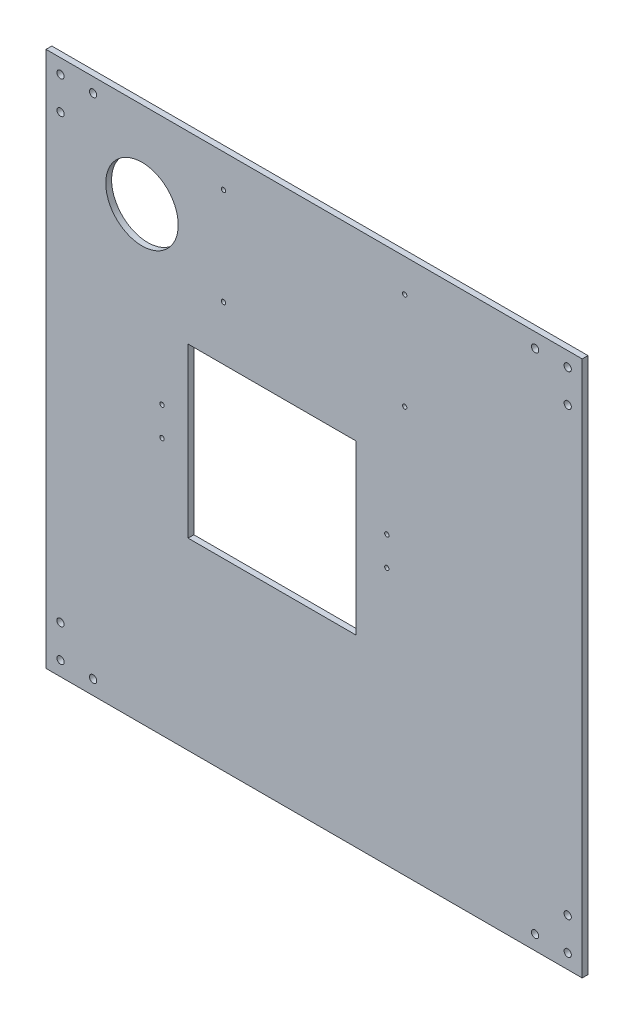
from build123d import *

# Parameters (mm, degrees)
SKETCH_1_W          = 370
SKETCH_1_H          = 370
EXTRUDE_1_DEPTH     = 4
SKETCH_2_R          = 2.5
CUT_EXTRUDE_1_DEPTH = 262.660084843
SKETCH_4_W          = 116
SKETCH_4_H          = 116
CUT_EXTRUDE_5_DEPTH = 262.660084843
SKETCH_6_R          = 1.5
CUT_EXTRUDE_7_DEPTH = 262.660084843
SKETCH_7_R          = 25
CUT_EXTRUDE_8_DEPTH = 262.660084843
SKETCH_8_R          = 1.5
CUT_EXTRUDE_9_DEPTH = 10


with BuildPart() as part:
    # 草图1 → 凸台-拉伸1 (new body)
    with BuildSketch(Plane.XY):
        Rectangle(SKETCH_1_W, SKETCH_1_H)
    extrude(amount=EXTRUDE_1_DEPTH)

    # 草图2 → 切除-拉伸1 (cut, through all)
    with BuildSketch(Plane.XY.offset(4)):
        with Locations((-175, -175)):
            Circle(SKETCH_2_R)
        with Locations((-152.5, -175)):
            Circle(SKETCH_2_R)
        with Locations((-175, -152.5)):
            Circle(SKETCH_2_R)
        with Locations((-152.5, 175)):
            Circle(SKETCH_2_R)
        with Locations((-175, 152.5)):
            Circle(SKETCH_2_R)
        with Locations((-175, 175)):
            Circle(SKETCH_2_R)
        with Locations((175, 152.5)):
            Circle(SKETCH_2_R)
        with Locations((152.5, 175)):
            Circle(SKETCH_2_R)
        with Locations((175, 175)):
            Circle(SKETCH_2_R)
        with Locations((152.5, -175)):
            Circle(SKETCH_2_R)
        with Locations((175, -152.5)):
            Circle(SKETCH_2_R)
        with Locations((175, -175)):
            Circle(SKETCH_2_R)
    extrude(amount=-CUT_EXTRUDE_1_DEPTH, mode=Mode.SUBTRACT)

    # 草图4 → 切除-拉伸5 (cut, through all)
    with BuildSketch(Plane(origin=(0, 0, 0), x_dir=(-1, 0, 0), z_dir=(0, 0, -1))):
        with Locations((28.956152895, -0.09)):
            Rectangle(SKETCH_4_W, SKETCH_4_H)
    extrude(amount=-CUT_EXTRUDE_5_DEPTH, mode=Mode.SUBTRACT)

    # 草图6 → 切除-拉伸7 (cut, through all)
    with BuildSketch(Plane(origin=(0, 0, 0), x_dir=(-1, 0, 0), z_dir=(0, 0, -1))):
        with Locations((-62.5, 162.249795252)):
            Circle(SKETCH_6_R)
        with Locations((-62.5, 95.249795252)):
            Circle(SKETCH_6_R)
        with Locations((62.5, 95.249795252)):
            Circle(SKETCH_6_R)
        with Locations((62.5, 162.249795252)):
            Circle(SKETCH_6_R)
    extrude(amount=-CUT_EXTRUDE_7_DEPTH, mode=Mode.SUBTRACT)

    # 草图7 → 切除-拉伸8 (cut, through all)
    with BuildSketch(Plane(origin=(0, 0, 0), x_dir=(-1, 0, 0), z_dir=(0, 0, -1))):
        with Locations((118.769854949, 125.631801741)):
            Circle(SKETCH_7_R)
    extrude(amount=-CUT_EXTRUDE_8_DEPTH, mode=Mode.SUBTRACT)

    # 草图8 → 切除-拉伸9 (cut)
    with BuildSketch(Plane(origin=(0, 0, 0), x_dir=(-1, 0, 0), z_dir=(0, 0, -1))):
        with Locations((-50.21335715, -7.305969028)):
            Circle(SKETCH_8_R)
        with Locations((-50.21335715, 12.694030972)):
            Circle(SKETCH_8_R)
        with Locations((104.956152895, -7.308718804)):
            Circle(SKETCH_8_R)
        with Locations((104.956152895, 12.691281196)):
            Circle(SKETCH_8_R)
    extrude(amount=-CUT_EXTRUDE_9_DEPTH, mode=Mode.SUBTRACT)


solid = part.part
